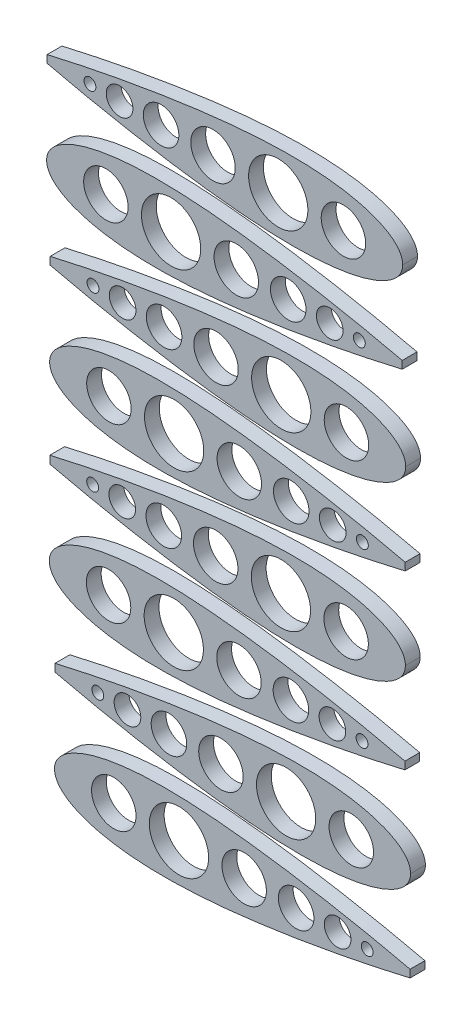
from build123d import *

# Parameters (mm, degrees)
SKETCH3_R             = 3
SKETCH3_R_2           = 2.4
SKETCH3_R_3           = 1.8
SKETCH3_R_4           = 4
SKETCH3_R_5           = 0.8
BOSS_EXTRUDE1_DEPTH   = 1
BOSS_EXTRUDE1_2_DEPTH = 1
BOSS_EXTRUDE1_3_DEPTH = 1
BOSS_EXTRUDE1_4_DEPTH = 1
BOSS_EXTRUDE1_5_DEPTH = 1
BOSS_EXTRUDE1_6_DEPTH = 1
BOSS_EXTRUDE1_7_DEPTH = 1
BOSS_EXTRUDE1_8_DEPTH = 1


with BuildPart() as part:
    # Sketch3 → Boss-Extrude1 (new, symmetric)
    with BuildSketch(Plane.XY):
        with BuildLine():
            Line((45.917800755, 0.750362197), (45.919419542, -0.277439389))
            add(Edge.make_bspline(
                [(-2.082199245, 0.160860129), (-2.081952194, 0.071640867), (-2.07374013, -0.084768844), (-2.041891142, -0.310220538), (-1.961048117, -0.604515456), (-1.847691772, -0.885275938), (-1.686732692, -1.179995064), (-1.462400089, -1.497179241), (-1.152579712, -1.842870259), (-0.722454312, -2.224944594), (-0.121936459, -2.648658184), (0.698645093, -3.103588606), (1.844645331, -3.594556504), (3.285096182, -4.051191861), (5.371913829, -4.526436716), (8.086354681, -4.894221024), (11.280495111, -5.076355831), (14.941589644, -5.044041079), (18.166549217, -4.858899542), (20.927079884, -4.614673365), (23.676919792, -4.315349446), (25.972237461, -4.022299468), (28.246613105, -3.698172579), (30.998270395, -3.265896123), (33.245205712, -2.887262497), (35.562136665, -2.465232179), (38.209721056, -1.95929534), (40.601787622, -1.467978059), (42.634192546, -1.035887238), (44.696860353, -0.564398536), (45.5105022, -0.374431444), (45.919419542, -0.277439389)],
                knots=[0, 0, 0, 0, 0, 0.006442135, 0.01132528, 0.01640633, 0.022022241, 0.028284763, 0.035552492, 0.04443509, 0.055515051, 0.069795494, 0.08858812, 0.112149618, 0.145519971, 0.178890371, 0.243189394, 0.309930212, 0.376671029, 0.443411848, 0.476782258, 0.510152669, 0.576893487, 0.610263899, 0.64363431, 0.710375129, 0.743745539, 0.77711595, 0.843856766, 0.877227178, 0.910597591, 0.910597591, 0.910597591, 0.910597591, 0.910597591], degree=4))
            add(Edge.make_bspline(
                [(-2.082199245, 0.160860129), (-2.082233235, 0.250079726), (-2.074513901, 0.406514529), (-2.043375242, 0.632065428), (-1.963459645, 0.926613542), (-1.850988256, 1.207729702), (-1.690958337, 1.502954386), (-1.467625975, 1.820843636), (-1.158896059, 2.16750887), (-0.729976324, 2.550936201), (-0.130796145, 2.976539316), (0.688348309, 3.434052306), (1.832796316, 3.92862766), (3.271801623, 4.389798161), (5.357111899, 4.871614117), (8.070380766, 5.247947068), (11.263931626, 5.440142488), (14.925109787, 5.419360316), (18.150636555, 5.244378295), (20.911922837, 5.00884898), (23.662691969, 4.71818852), (25.958921356, 4.432370228), (28.234306714, 4.115409213), (30.987312019, 3.691802601), (33.235428882, 3.320248681), (35.553677732, 2.905518772), (38.202842685, 2.407924313), (40.596445029, 1.924144461), (42.630200953, 1.498457843), (44.694343712, 1.033468868), (45.508579917, 0.846065684), (45.917800755, 0.750362197)],
                knots=[0, 0, 0, 0, 0, 0.006442135, 0.01132528, 0.01640633, 0.022022241, 0.028284763, 0.035552492, 0.04443509, 0.055515051, 0.069795494, 0.08858812, 0.112149618, 0.145519971, 0.178890371, 0.243189394, 0.309930212, 0.376671029, 0.443411848, 0.476782258, 0.510152669, 0.576893487, 0.610263899, 0.64363431, 0.710375129, 0.743745539, 0.77711595, 0.843856766, 0.877227178, 0.910597591, 0.910597591, 0.910597591, 0.910597591, 0.910597591], degree=4))
        make_face()
        with Locations((5.917800755, 0.170201873)):
            Circle(SKETCH3_R, mode=Mode.SUBTRACT)
        with Locations((23.517800755, 0.19075371)):
            Circle(SKETCH3_R, mode=Mode.SUBTRACT)
        with Locations((30.531078192, 0.19894324)):
            Circle(SKETCH3_R_2, mode=Mode.SUBTRACT)
        with Locations((36.131078192, 0.205482461)):
            Circle(SKETCH3_R_3, mode=Mode.SUBTRACT)
        with Locations((14.717800755, 0.180477791)):
            Circle(SKETCH3_R_4, mode=Mode.SUBTRACT)
        with Locations((40.131078192, 0.210153333)):
            Circle(SKETCH3_R_5, mode=Mode.SUBTRACT)
    extrude(amount=BOSS_EXTRUDE1_DEPTH, both=True)


with BuildPart() as body_2:
    # Sketch3 → Boss-Extrude1 2 (new, symmetric)
    with BuildSketch(Plane.XY):
        with BuildLine():
            Line((-2.019643238, 12.538517767), (-2.021262026, 11.510716181))
            add(Edge.make_bspline(
                [(45.980356762, 11.949015699), (45.98010971, 11.859796438), (45.971897646, 11.703386726), (45.940048659, 11.477935033), (45.859205633, 11.183640115), (45.745849288, 10.902879633), (45.584890208, 10.608160506), (45.360557605, 10.290976329), (45.050737228, 9.945285311), (44.620611829, 9.563210977), (44.020093975, 9.139497386), (43.199512423, 8.684566965), (42.053512186, 8.193599066), (40.613061334, 7.736963709), (38.526243688, 7.261718855), (35.811802835, 6.893934546), (32.617662406, 6.71179974), (28.956567872, 6.744114492), (25.731608299, 6.929256029), (22.971077632, 7.173482206), (20.221237725, 7.472806125), (17.925920056, 7.765856103), (15.651544412, 8.089982992), (12.899887122, 8.522259447), (10.652951805, 8.900893074), (8.336020852, 9.322923391), (5.68843646, 9.82886023), (3.296369895, 10.320177511), (1.26396497, 10.752268333), (-0.798702837, 11.223757035), (-1.612344683, 11.413724126), (-2.021262026, 11.510716181)],
                knots=[0, 0, 0, 0, 0, 0.006442135, 0.01132528, 0.01640633, 0.022022241, 0.028284763, 0.035552492, 0.04443509, 0.055515051, 0.069795494, 0.08858812, 0.112149618, 0.145519971, 0.178890371, 0.243189394, 0.309930212, 0.376671029, 0.443411848, 0.476782258, 0.510152669, 0.576893487, 0.610263899, 0.64363431, 0.710375129, 0.743745539, 0.77711595, 0.843856766, 0.877227178, 0.910597591, 0.910597591, 0.910597591, 0.910597591, 0.910597591], degree=4))
            add(Edge.make_bspline(
                [(45.980356762, 11.949015699), (45.980390752, 12.038235297), (45.972671418, 12.1946701), (45.941532759, 12.420220999), (45.861617162, 12.714769112), (45.749145772, 12.995885272), (45.589115854, 13.291109956), (45.365783492, 13.608999206), (45.057053575, 13.95566444), (44.628133841, 14.339091771), (44.028953661, 14.764694886), (43.209809208, 15.222207876), (42.065361201, 15.716783231), (40.626355894, 16.177953731), (38.541045618, 16.659769687), (35.82777675, 17.036102638), (32.634225891, 17.228298059), (28.973047729, 17.207515886), (25.747520962, 17.032533865), (22.98623468, 16.79700455), (20.235465547, 16.50634409), (17.93923616, 16.220525799), (15.663850803, 15.903564783), (12.910845498, 15.479958171), (10.662728635, 15.108404252), (8.344479784, 14.693674342), (5.695314831, 14.196079884), (3.301712488, 13.712300031), (1.267956564, 13.286613413), (-0.796186196, 12.821624438), (-1.6104224, 12.634221254), (-2.019643238, 12.538517767)],
                knots=[0, 0, 0, 0, 0, 0.006442135, 0.01132528, 0.01640633, 0.022022241, 0.028284763, 0.035552492, 0.04443509, 0.055515051, 0.069795494, 0.08858812, 0.112149618, 0.145519971, 0.178890371, 0.243189394, 0.309930212, 0.376671029, 0.443411848, 0.476782258, 0.510152669, 0.576893487, 0.610263899, 0.64363431, 0.710375129, 0.743745539, 0.77711595, 0.843856766, 0.877227178, 0.910597591, 0.910597591, 0.910597591, 0.910597591, 0.910597591], degree=4))
        make_face()
        with Locations(Location((3.767079325, 11.998308903, 0), (0, 0, 180))):
            Circle(SKETCH3_R_5, mode=Mode.SUBTRACT)
        with Locations(Location((29.180356762, 11.968633362, 0), (0, 0, 180))):
            Circle(SKETCH3_R_4, mode=Mode.SUBTRACT)
        with Locations(Location((7.767079325, 11.993638031, 0), (0, 0, 180))):
            Circle(SKETCH3_R_3, mode=Mode.SUBTRACT)
        with Locations(Location((13.367079325, 11.987098811, 0), (0, 0, 180))):
            Circle(SKETCH3_R_2, mode=Mode.SUBTRACT)
        with Locations(Location((20.380356762, 11.97890928, 0), (0, 0, 180))):
            Circle(SKETCH3_R, mode=Mode.SUBTRACT)
        with Locations(Location((37.980356762, 11.958357443, 0), (0, 0, 180))):
            Circle(SKETCH3_R, mode=Mode.SUBTRACT)
    extrude(amount=BOSS_EXTRUDE1_2_DEPTH, both=True)


with BuildPart() as body_3:
    # Sketch3 → Boss-Extrude1 3 (new, symmetric)
    with BuildSketch(Plane.XY):
        with BuildLine():
            Line((45.216926206, 24.72516597), (45.218544993, 23.697364385))
            add(Edge.make_bspline(
                [(-2.783073794, 24.135663903), (-2.782826743, 24.046444641), (-2.774614679, 23.89003493), (-2.742765691, 23.664583236), (-2.661922666, 23.370288318), (-2.548566321, 23.089527836), (-2.387607241, 22.79480871), (-2.163274638, 22.477624532), (-1.853454261, 22.131933515), (-1.423328861, 21.74985918), (-0.822811008, 21.326145589), (-0.002229456, 20.871215168), (1.143770782, 20.380247269), (2.584221633, 19.923611913), (4.67103928, 19.448367058), (7.385480132, 19.08058275), (10.579620562, 18.898447943), (14.240715095, 18.930762695), (17.465674669, 19.115904232), (20.226205335, 19.360130409), (22.976045243, 19.659454328), (25.271362912, 19.952504306), (27.545738556, 20.276631195), (30.297395846, 20.70890765), (32.544331163, 21.087541277), (34.861262116, 21.509571595), (37.508846507, 22.015508434), (39.900913073, 22.506825715), (41.933317997, 22.938916536), (43.995985804, 23.410405238), (44.809627651, 23.60037233), (45.218544993, 23.697364385)],
                knots=[0, 0, 0, 0, 0, 0.006442135, 0.01132528, 0.01640633, 0.022022241, 0.028284763, 0.035552492, 0.04443509, 0.055515051, 0.069795494, 0.08858812, 0.112149618, 0.145519971, 0.178890371, 0.243189394, 0.309930212, 0.376671029, 0.443411848, 0.476782258, 0.510152669, 0.576893487, 0.610263899, 0.64363431, 0.710375129, 0.743745539, 0.77711595, 0.843856766, 0.877227178, 0.910597591, 0.910597591, 0.910597591, 0.910597591, 0.910597591], degree=4))
            add(Edge.make_bspline(
                [(-2.783073794, 24.135663903), (-2.783107784, 24.2248835), (-2.77538845, 24.381318303), (-2.744249791, 24.606869202), (-2.664334194, 24.901417315), (-2.551862805, 25.182533476), (-2.391832886, 25.47775816), (-2.168500524, 25.795647409), (-1.859770608, 26.142312644), (-1.430850873, 26.525739974), (-0.831670694, 26.95134309), (-0.01252624, 27.408856079), (1.131921767, 27.903431434), (2.570927074, 28.364601934), (4.65623735, 28.84641789), (7.369506217, 29.222750841), (10.563057077, 29.414946262), (14.224235238, 29.39416409), (17.449762006, 29.219182068), (20.211048288, 28.983652753), (22.96181742, 28.692992293), (25.258046807, 28.407174002), (27.533432165, 28.090212986), (30.28643747, 27.666606375), (32.534554333, 27.295052455), (34.852803183, 26.880322546), (37.501968136, 26.382728087), (39.89557048, 25.898948235), (41.929326404, 25.473261617), (43.993469163, 25.008272641), (44.807705368, 24.820869458), (45.216926206, 24.72516597)],
                knots=[0, 0, 0, 0, 0, 0.006442135, 0.01132528, 0.01640633, 0.022022241, 0.028284763, 0.035552492, 0.04443509, 0.055515051, 0.069795494, 0.08858812, 0.112149618, 0.145519971, 0.178890371, 0.243189394, 0.309930212, 0.376671029, 0.443411848, 0.476782258, 0.510152669, 0.576893487, 0.610263899, 0.64363431, 0.710375129, 0.743745539, 0.77711595, 0.843856766, 0.877227178, 0.910597591, 0.910597591, 0.910597591, 0.910597591, 0.910597591], degree=4))
        make_face()
        with Locations((5.216926206, 24.145005647)):
            Circle(SKETCH3_R, mode=Mode.SUBTRACT)
        with Locations((22.816926206, 24.165557483)):
            Circle(SKETCH3_R, mode=Mode.SUBTRACT)
        with Locations((29.830203643, 24.173747014)):
            Circle(SKETCH3_R_2, mode=Mode.SUBTRACT)
        with Locations((35.430203643, 24.180286235)):
            Circle(SKETCH3_R_3, mode=Mode.SUBTRACT)
        with Locations((14.016926206, 24.155281565)):
            Circle(SKETCH3_R_4, mode=Mode.SUBTRACT)
        with Locations((39.430203643, 24.184957107)):
            Circle(SKETCH3_R_5, mode=Mode.SUBTRACT)
    extrude(amount=BOSS_EXTRUDE1_3_DEPTH, both=True)


with BuildPart() as body_4:
    # Sketch3 → Boss-Extrude1 4 (new, symmetric)
    with BuildSketch(Plane.XY):
        with BuildLine():
            Line((-2.720517787, 36.513321541), (-2.722136575, 35.485519955))
            add(Edge.make_bspline(
                [(45.279482213, 35.923819473), (45.279235161, 35.834600211), (45.271023097, 35.6781905), (45.23917411, 35.452738807), (45.158331084, 35.158443888), (45.044974739, 34.877683407), (44.884015659, 34.58296428), (44.659683056, 34.265780103), (44.349862679, 33.920089085), (43.91973728, 33.538014751), (43.319219426, 33.11430116), (42.498637874, 32.659370738), (41.352637637, 32.16840284), (39.912186785, 31.711767483), (37.825369139, 31.236522629), (35.110928287, 30.86873832), (31.916787857, 30.686603513), (28.255693323, 30.718918265), (25.03073375, 30.904059803), (22.270203083, 31.148285979), (19.520363176, 31.447609898), (17.225045507, 31.740659876), (14.950669863, 32.064786765), (12.199012573, 32.497063221), (9.952077256, 32.875696848), (7.635146303, 33.297727165), (4.987561911, 33.803664004), (2.595495346, 34.294981285), (0.563090421, 34.727072106), (-1.499577386, 35.198560808), (-2.313219232, 35.3885279), (-2.722136575, 35.485519955)],
                knots=[0, 0, 0, 0, 0, 0.006442135, 0.01132528, 0.01640633, 0.022022241, 0.028284763, 0.035552492, 0.04443509, 0.055515051, 0.069795494, 0.08858812, 0.112149618, 0.145519971, 0.178890371, 0.243189394, 0.309930212, 0.376671029, 0.443411848, 0.476782258, 0.510152669, 0.576893487, 0.610263899, 0.64363431, 0.710375129, 0.743745539, 0.77711595, 0.843856766, 0.877227178, 0.910597591, 0.910597591, 0.910597591, 0.910597591, 0.910597591], degree=4))
            add(Edge.make_bspline(
                [(45.279482213, 35.923819473), (45.279516203, 36.01303907), (45.271796869, 36.169473873), (45.24065821, 36.395024773), (45.160742613, 36.689572886), (45.048271223, 36.970689046), (44.888241305, 37.26591373), (44.664908943, 37.58380298), (44.356179026, 37.930468214), (43.927259292, 38.313895545), (43.328079112, 38.73949866), (42.508934659, 39.19701165), (41.364486652, 39.691587005), (39.925481345, 40.152757505), (37.840171069, 40.634573461), (35.126902201, 41.010906412), (31.933351342, 41.203101832), (28.27217318, 41.18231966), (25.046646413, 41.007337639), (22.285360131, 40.771808324), (19.534590998, 40.481147864), (17.238361611, 40.195329572), (14.962976254, 39.878368557), (12.209970949, 39.454761945), (9.961854086, 39.083208026), (7.643605235, 38.668478116), (4.994440282, 38.170883657), (2.600837939, 37.687103805), (0.567082015, 37.261417187), (-1.497060745, 36.796428212), (-2.311296949, 36.609025028), (-2.720517787, 36.513321541)],
                knots=[0, 0, 0, 0, 0, 0.006442135, 0.01132528, 0.01640633, 0.022022241, 0.028284763, 0.035552492, 0.04443509, 0.055515051, 0.069795494, 0.08858812, 0.112149618, 0.145519971, 0.178890371, 0.243189394, 0.309930212, 0.376671029, 0.443411848, 0.476782258, 0.510152669, 0.576893487, 0.610263899, 0.64363431, 0.710375129, 0.743745539, 0.77711595, 0.843856766, 0.877227178, 0.910597591, 0.910597591, 0.910597591, 0.910597591, 0.910597591], degree=4))
        make_face()
        with Locations(Location((3.066204776, 35.973112677, 0), (0, 0, 180))):
            Circle(SKETCH3_R_5, mode=Mode.SUBTRACT)
        with Locations(Location((28.479482213, 35.943437135, 0), (0, 0, 180))):
            Circle(SKETCH3_R_4, mode=Mode.SUBTRACT)
        with Locations(Location((7.066204776, 35.968441805, 0), (0, 0, 180))):
            Circle(SKETCH3_R_3, mode=Mode.SUBTRACT)
        with Locations(Location((12.666204776, 35.961902584, 0), (0, 0, 180))):
            Circle(SKETCH3_R_2, mode=Mode.SUBTRACT)
        with Locations(Location((19.679482213, 35.953713054, 0), (0, 0, 180))):
            Circle(SKETCH3_R, mode=Mode.SUBTRACT)
        with Locations(Location((37.279482213, 35.933161217, 0), (0, 0, 180))):
            Circle(SKETCH3_R, mode=Mode.SUBTRACT)
    extrude(amount=BOSS_EXTRUDE1_4_DEPTH, both=True)


with BuildPart() as body_5:
    # Sketch3 → Boss-Extrude1 5 (new, symmetric)
    with BuildSketch(Plane.XY):
        with BuildLine():
            Line((45.26192229, 47.996607663), (45.263541077, 46.968806077))
            add(Edge.make_bspline(
                [(-2.73807771, 47.407105596), (-2.737830659, 47.317886334), (-2.729618595, 47.161476623), (-2.697769607, 46.936024929), (-2.616926582, 46.641730011), (-2.503570237, 46.360969529), (-2.342611157, 46.066250403), (-2.118278554, 45.749066225), (-1.808458177, 45.403375208), (-1.378332777, 45.021300873), (-0.777814924, 44.597587282), (0.042766628, 44.142656861), (1.188766866, 43.651688962), (2.629217717, 43.195053606), (4.716035364, 42.719808751), (7.430476216, 42.352024443), (10.624616646, 42.169889636), (14.285711179, 42.202204388), (17.510670752, 42.387345925), (20.271201419, 42.631572102), (23.021041327, 42.930896021), (25.316358996, 43.223945999), (27.59073464, 43.548072888), (30.34239193, 43.980349343), (32.589327247, 44.35898297), (34.9062582, 44.781013288), (37.553842591, 45.286950127), (39.945909157, 45.778267408), (41.978314081, 46.210358229), (44.040981888, 46.681846931), (44.854623735, 46.871814022), (45.263541077, 46.968806077)],
                knots=[0, 0, 0, 0, 0, 0.006442135, 0.01132528, 0.01640633, 0.022022241, 0.028284763, 0.035552492, 0.04443509, 0.055515051, 0.069795494, 0.08858812, 0.112149618, 0.145519971, 0.178890371, 0.243189394, 0.309930212, 0.376671029, 0.443411848, 0.476782258, 0.510152669, 0.576893487, 0.610263899, 0.64363431, 0.710375129, 0.743745539, 0.77711595, 0.843856766, 0.877227178, 0.910597591, 0.910597591, 0.910597591, 0.910597591, 0.910597591], degree=4))
            add(Edge.make_bspline(
                [(-2.73807771, 47.407105596), (-2.7381117, 47.496325193), (-2.730392366, 47.652759996), (-2.699253707, 47.878310895), (-2.61933811, 48.172859008), (-2.506866721, 48.453975169), (-2.346836802, 48.749199853), (-2.12350444, 49.067089102), (-1.814774524, 49.413754337), (-1.38585479, 49.797181667), (-0.78667461, 50.222784783), (0.032469844, 50.680297772), (1.17691785, 51.174873127), (2.615923158, 51.636043627), (4.701233434, 52.117859583), (7.414502301, 52.494192534), (10.608053161, 52.686387955), (14.269231322, 52.665605783), (17.49475809, 52.490623761), (20.256044372, 52.255094446), (23.006813504, 51.964433986), (25.303042891, 51.678615695), (27.578428249, 51.361654679), (30.331433554, 50.938048068), (32.579550417, 50.566494148), (34.897799267, 50.151764239), (37.54696422, 49.65416978), (39.940566564, 49.170389928), (41.974322488, 48.74470331), (44.038465247, 48.279714334), (44.852701452, 48.092311151), (45.26192229, 47.996607663)],
                knots=[0, 0, 0, 0, 0, 0.006442135, 0.01132528, 0.01640633, 0.022022241, 0.028284763, 0.035552492, 0.04443509, 0.055515051, 0.069795494, 0.08858812, 0.112149618, 0.145519971, 0.178890371, 0.243189394, 0.309930212, 0.376671029, 0.443411848, 0.476782258, 0.510152669, 0.576893487, 0.610263899, 0.64363431, 0.710375129, 0.743745539, 0.77711595, 0.843856766, 0.877227178, 0.910597591, 0.910597591, 0.910597591, 0.910597591, 0.910597591], degree=4))
        make_face()
        with Locations((5.26192229, 47.41644734)):
            Circle(SKETCH3_R, mode=Mode.SUBTRACT)
        with Locations((22.86192229, 47.436999176)):
            Circle(SKETCH3_R, mode=Mode.SUBTRACT)
        with Locations((29.875199727, 47.445188707)):
            Circle(SKETCH3_R_2, mode=Mode.SUBTRACT)
        with Locations((35.475199727, 47.451727928)):
            Circle(SKETCH3_R_3, mode=Mode.SUBTRACT)
        with Locations((14.06192229, 47.426723258)):
            Circle(SKETCH3_R_4, mode=Mode.SUBTRACT)
        with Locations((39.475199727, 47.4563988)):
            Circle(SKETCH3_R_5, mode=Mode.SUBTRACT)
    extrude(amount=BOSS_EXTRUDE1_5_DEPTH, both=True)


with BuildPart() as body_6:
    # Sketch3 → Boss-Extrude1 6 (new, symmetric)
    with BuildSketch(Plane.XY):
        with BuildLine():
            Line((-2.675521703, 59.784763234), (-2.677140491, 58.756961648))
            add(Edge.make_bspline(
                [(45.324478297, 59.195261166), (45.324231245, 59.106041904), (45.316019181, 58.949632193), (45.284170194, 58.724180499), (45.203327168, 58.429885581), (45.089970823, 58.1491251), (44.929011743, 57.854405973), (44.70467914, 57.537221796), (44.394858763, 57.191530778), (43.964733364, 56.809456443), (43.36421551, 56.385742853), (42.543633958, 55.930812431), (41.397633721, 55.439844533), (39.957182869, 54.983209176), (37.870365223, 54.507964321), (35.15592437, 54.140180013), (31.961783941, 53.958045206), (28.300689407, 53.990359958), (25.075729834, 54.175501495), (22.315199167, 54.419727672), (19.56535926, 54.719051591), (17.270041591, 55.012101569), (14.995665947, 55.336228458), (12.244008657, 55.768504914), (9.99707334, 56.147138541), (7.680142387, 56.569168858), (5.032557995, 57.075105697), (2.64049143, 57.566422978), (0.608086505, 57.998513799), (-1.454581302, 58.470002501), (-2.268223148, 58.659969593), (-2.677140491, 58.756961648)],
                knots=[0, 0, 0, 0, 0, 0.006442135, 0.01132528, 0.01640633, 0.022022241, 0.028284763, 0.035552492, 0.04443509, 0.055515051, 0.069795494, 0.08858812, 0.112149618, 0.145519971, 0.178890371, 0.243189394, 0.309930212, 0.376671029, 0.443411848, 0.476782258, 0.510152669, 0.576893487, 0.610263899, 0.64363431, 0.710375129, 0.743745539, 0.77711595, 0.843856766, 0.877227178, 0.910597591, 0.910597591, 0.910597591, 0.910597591, 0.910597591], degree=4))
            add(Edge.make_bspline(
                [(45.324478297, 59.195261166), (45.324512286, 59.284480763), (45.316792953, 59.440915566), (45.285654294, 59.666466465), (45.205738697, 59.961014579), (45.093267307, 60.242130739), (44.933237389, 60.537355423), (44.709905026, 60.855244673), (44.40117511, 61.201909907), (43.972255376, 61.585337238), (43.373075196, 62.010940353), (42.553930743, 62.468453343), (41.409482736, 62.963028698), (39.970477429, 63.424199198), (37.885167153, 63.906015154), (35.171898285, 64.282348105), (31.978347426, 64.474543525), (28.317169264, 64.453761353), (25.091642497, 64.278779332), (22.330356215, 64.043250017), (19.579587082, 63.752589557), (17.283357695, 63.466771265), (15.007972338, 63.14981025), (12.254967032, 62.726203638), (10.00685017, 62.354649719), (7.688601319, 61.939919809), (5.039436366, 61.44232535), (2.645834023, 60.958545498), (0.612078099, 60.53285888), (-1.452064661, 60.067869905), (-2.266300865, 59.880466721), (-2.675521703, 59.784763234)],
                knots=[0, 0, 0, 0, 0, 0.006442135, 0.01132528, 0.01640633, 0.022022241, 0.028284763, 0.035552492, 0.04443509, 0.055515051, 0.069795494, 0.08858812, 0.112149618, 0.145519971, 0.178890371, 0.243189394, 0.309930212, 0.376671029, 0.443411848, 0.476782258, 0.510152669, 0.576893487, 0.610263899, 0.64363431, 0.710375129, 0.743745539, 0.77711595, 0.843856766, 0.877227178, 0.910597591, 0.910597591, 0.910597591, 0.910597591, 0.910597591], degree=4))
        make_face()
        with Locations(Location((3.11120086, 59.24455437, 0), (0, 0, 180))):
            Circle(SKETCH3_R_5, mode=Mode.SUBTRACT)
        with Locations(Location((28.524478297, 59.214878828, 0), (0, 0, 180))):
            Circle(SKETCH3_R_4, mode=Mode.SUBTRACT)
        with Locations(Location((7.11120086, 59.239883498, 0), (0, 0, 180))):
            Circle(SKETCH3_R_3, mode=Mode.SUBTRACT)
        with Locations(Location((12.71120086, 59.233344277, 0), (0, 0, 180))):
            Circle(SKETCH3_R_2, mode=Mode.SUBTRACT)
        with Locations(Location((19.724478297, 59.225154747, 0), (0, 0, 180))):
            Circle(SKETCH3_R, mode=Mode.SUBTRACT)
        with Locations(Location((37.324478297, 59.20460291, 0), (0, 0, 180))):
            Circle(SKETCH3_R, mode=Mode.SUBTRACT)
    extrude(amount=BOSS_EXTRUDE1_6_DEPTH, both=True)


with BuildPart() as body_7:
    # Sketch3 → Boss-Extrude1 7 (new, symmetric)
    with BuildSketch(Plane.XY):
        with BuildLine():
            Line((44.854186149, 71.383351959), (44.855804936, 70.355550373))
            add(Edge.make_bspline(
                [(-3.145813851, 70.793849891), (-3.145566799, 70.704630629), (-3.137354736, 70.548220918), (-3.105505748, 70.322769224), (-3.024662723, 70.028474306), (-2.911306377, 69.747713824), (-2.750347298, 69.452994698), (-2.526014695, 69.135810521), (-2.216194317, 68.790119503), (-1.786068918, 68.408045168), (-1.185551065, 67.984331578), (-0.364969512, 67.529401156), (0.781030725, 67.038433258), (2.221481577, 66.581797901), (4.308299223, 66.106553046), (7.022740075, 65.738768738), (10.216880505, 65.556633931), (13.877975039, 65.588948683), (17.102934612, 65.77409022), (19.863465279, 66.018316397), (22.613305186, 66.317640316), (24.908622855, 66.610690294), (27.182998499, 66.934817183), (29.934655789, 67.367093639), (32.181591106, 67.745727265), (34.498522059, 68.167757583), (37.146106451, 68.673694422), (39.538173016, 69.165011703), (41.570577941, 69.597102524), (43.633245748, 70.068591226), (44.446887594, 70.258558318), (44.855804936, 70.355550373)],
                knots=[0, 0, 0, 0, 0, 0.006442135, 0.01132528, 0.01640633, 0.022022241, 0.028284763, 0.035552492, 0.04443509, 0.055515051, 0.069795494, 0.08858812, 0.112149618, 0.145519971, 0.178890371, 0.243189394, 0.309930212, 0.376671029, 0.443411848, 0.476782258, 0.510152669, 0.576893487, 0.610263899, 0.64363431, 0.710375129, 0.743745539, 0.77711595, 0.843856766, 0.877227178, 0.910597591, 0.910597591, 0.910597591, 0.910597591, 0.910597591], degree=4))
            add(Edge.make_bspline(
                [(-3.145813851, 70.793849891), (-3.145847841, 70.883069488), (-3.138128507, 71.039504291), (-3.106989848, 71.26505519), (-3.027074251, 71.559603304), (-2.914602861, 71.840719464), (-2.754572943, 72.135944148), (-2.531240581, 72.453833398), (-2.222510665, 72.800498632), (-1.79359093, 73.183925963), (-1.194410751, 73.609529078), (-0.375266297, 74.067042068), (0.76918171, 74.561617422), (2.208187017, 75.022787923), (4.293497293, 75.504603878), (7.006766161, 75.88093683), (10.20031702, 76.07313225), (13.861495181, 76.052350078), (17.087021949, 75.877368057), (19.848308231, 75.641838742), (22.599077363, 75.351178282), (24.89530675, 75.06535999), (27.170692108, 74.748398975), (29.923697413, 74.324792363), (32.171814276, 73.953238443), (34.490063126, 73.538508534), (37.13922808, 73.040914075), (39.532830423, 72.557134223), (41.566586347, 72.131447605), (43.630729106, 71.66645863), (44.444965311, 71.479055446), (44.854186149, 71.383351959)],
                knots=[0, 0, 0, 0, 0, 0.006442135, 0.01132528, 0.01640633, 0.022022241, 0.028284763, 0.035552492, 0.04443509, 0.055515051, 0.069795494, 0.08858812, 0.112149618, 0.145519971, 0.178890371, 0.243189394, 0.309930212, 0.376671029, 0.443411848, 0.476782258, 0.510152669, 0.576893487, 0.610263899, 0.64363431, 0.710375129, 0.743745539, 0.77711595, 0.843856766, 0.877227178, 0.910597591, 0.910597591, 0.910597591, 0.910597591, 0.910597591], degree=4))
        make_face()
        with Locations((4.854186149, 70.803191635)):
            Circle(SKETCH3_R, mode=Mode.SUBTRACT)
        with Locations((22.454186149, 70.823743472)):
            Circle(SKETCH3_R, mode=Mode.SUBTRACT)
        with Locations((29.467463586, 70.831933002)):
            Circle(SKETCH3_R_2, mode=Mode.SUBTRACT)
        with Locations((35.067463586, 70.838472223)):
            Circle(SKETCH3_R_3, mode=Mode.SUBTRACT)
        with Locations((13.654186149, 70.813467553)):
            Circle(SKETCH3_R_4, mode=Mode.SUBTRACT)
        with Locations((39.067463586, 70.843143095)):
            Circle(SKETCH3_R_5, mode=Mode.SUBTRACT)
    extrude(amount=BOSS_EXTRUDE1_7_DEPTH, both=True)


with BuildPart() as body_8:
    # Sketch3 → Boss-Extrude1 8 (new, symmetric)
    with BuildSketch(Plane.XY):
        with BuildLine():
            Line((-3.083257844, 83.171507529), (-3.084876631, 82.143705943))
            add(Edge.make_bspline(
                [(44.916742156, 82.582005461), (44.916495105, 82.4927862), (44.908283041, 82.336376488), (44.876434053, 82.110924795), (44.795591028, 81.816629876), (44.682234683, 81.535869395), (44.521275603, 81.241150268), (44.296943, 80.923966091), (43.987122623, 80.578275073), (43.556997223, 80.196200739), (42.95647937, 79.772487148), (42.135897818, 79.317556727), (40.98989758, 78.826588828), (39.549446728, 78.369953471), (37.462629082, 77.894708617), (34.74818823, 77.526924308), (31.5540478, 77.344789502), (27.892953266, 77.377104254), (24.667993693, 77.562245791), (21.907463026, 77.806471967), (19.157623119, 78.105795887), (16.86230545, 78.398845865), (14.587929806, 78.722972754), (11.836272516, 79.155249209), (9.589337199, 79.533882836), (7.272406246, 79.955913153), (4.624821855, 80.461849992), (2.232755289, 80.953167273), (0.200350365, 81.385258095), (-1.862317443, 81.856746797), (-2.675959289, 82.046713888), (-3.084876631, 82.143705943)],
                knots=[0, 0, 0, 0, 0, 0.006442135, 0.01132528, 0.01640633, 0.022022241, 0.028284763, 0.035552492, 0.04443509, 0.055515051, 0.069795494, 0.08858812, 0.112149618, 0.145519971, 0.178890371, 0.243189394, 0.309930212, 0.376671029, 0.443411848, 0.476782258, 0.510152669, 0.576893487, 0.610263899, 0.64363431, 0.710375129, 0.743745539, 0.77711595, 0.843856766, 0.877227178, 0.910597591, 0.910597591, 0.910597591, 0.910597591, 0.910597591], degree=4))
            add(Edge.make_bspline(
                [(44.916742156, 82.582005461), (44.916776146, 82.671225059), (44.909056812, 82.827659862), (44.877918153, 83.053210761), (44.798002556, 83.347758874), (44.685531166, 83.628875034), (44.525501248, 83.924099718), (44.302168886, 84.241988968), (43.99343897, 84.588654202), (43.564519235, 84.972081533), (42.965339056, 85.397684648), (42.146194602, 85.855197638), (41.001746595, 86.349772993), (39.562741288, 86.810943493), (37.477431012, 87.292759449), (34.764162144, 87.6690924), (31.570611285, 87.861287821), (27.909433124, 87.840505648), (24.683906356, 87.665523627), (21.922620074, 87.429994312), (19.171850942, 87.139333852), (16.875621555, 86.853515561), (14.600236197, 86.536554545), (11.847230892, 86.112947933), (9.599114029, 85.741394014), (7.280865179, 85.326664104), (4.631700225, 84.829069646), (2.238097882, 84.345289793), (0.204341958, 83.919603175), (-1.859800801, 83.4546142), (-2.674037006, 83.267211016), (-3.083257844, 83.171507529)],
                knots=[0, 0, 0, 0, 0, 0.006442135, 0.01132528, 0.01640633, 0.022022241, 0.028284763, 0.035552492, 0.04443509, 0.055515051, 0.069795494, 0.08858812, 0.112149618, 0.145519971, 0.178890371, 0.243189394, 0.309930212, 0.376671029, 0.443411848, 0.476782258, 0.510152669, 0.576893487, 0.610263899, 0.64363431, 0.710375129, 0.743745539, 0.77711595, 0.843856766, 0.877227178, 0.910597591, 0.910597591, 0.910597591, 0.910597591, 0.910597591], degree=4))
        make_face()
        with Locations(Location((2.703464719, 82.631298665, 0), (0, 0, 180))):
            Circle(SKETCH3_R_5, mode=Mode.SUBTRACT)
        with Locations(Location((28.116742156, 82.601623124, 0), (0, 0, 180))):
            Circle(SKETCH3_R_4, mode=Mode.SUBTRACT)
        with Locations(Location((6.703464719, 82.626627793, 0), (0, 0, 180))):
            Circle(SKETCH3_R_3, mode=Mode.SUBTRACT)
        with Locations(Location((12.303464719, 82.620088572, 0), (0, 0, 180))):
            Circle(SKETCH3_R_2, mode=Mode.SUBTRACT)
        with Locations(Location((19.316742156, 82.611899042, 0), (0, 0, 180))):
            Circle(SKETCH3_R, mode=Mode.SUBTRACT)
        with Locations(Location((36.916742156, 82.591347205, 0), (0, 0, 180))):
            Circle(SKETCH3_R, mode=Mode.SUBTRACT)
    extrude(amount=BOSS_EXTRUDE1_8_DEPTH, both=True)


solid = Compound([part.part, body_2.part, body_3.part, body_4.part, body_5.part, body_6.part, body_7.part, body_8.part])
